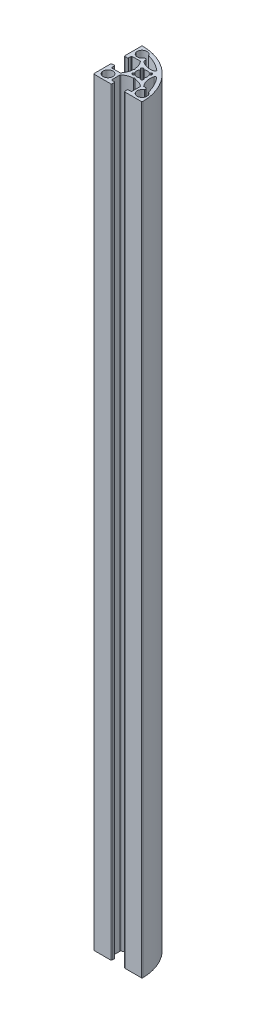
from build123d import *

# Parameters (mm, degrees)
SKETCH_1_R      = 2
EXTRUDE_1_DEPTH = 312


with BuildPart() as part:
    # 스케치1 → 보스-돌출1 (new body)
    with BuildSketch(Plane(origin=(0, 0, 0), x_dir=(1, 0, 0), z_dir=(0, 1, 0))):
        with BuildLine():
            Line((-10, 9.697715604), (-10, 2.95))
            ThreePointArc((-10, 2.95), (-9.912132034, 2.737867966), (-9.7, 2.65))
            Line((-9.7, 2.65), (-8.8, 2.65))
            ThreePointArc((-8.8, 2.65), (-8.587867966, 2.737867966), (-8.5, 2.95))
            Line((-8.5, 2.95), (-8.5, 3.85))
            ThreePointArc((-8.5, 3.85), (-8.412132034, 4.062132034), (-8.2, 4.15))
            Line((-8.2, 4.15), (-4.942749448, 4.15))
            ThreePointArc((-4.942749448, 4.15), (-4.812307598, 4.120157221), (-4.707817398, 4.03656616))
            ThreePointArc((-4.707817398, 4.03656616), (-3.714379176, 2.282021525), (-3.307277366, 0.307277366))
            Line((-3.307277366, 0.307277366), (-3, 0))
            Line((-3, 0), (-3.307277366, -0.307277366))
            ThreePointArc((-3.307277366, -0.307277366), (-3.714379176, -2.282021525), (-4.707817398, -4.03656616))
            ThreePointArc((-4.707817398, -4.03656616), (-4.812307598, -4.120157221), (-4.942749448, -4.15))
            Line((-4.942749448, -4.15), (-8.2, -4.15))
            ThreePointArc((-8.2, -4.15), (-8.412132034, -4.062132034), (-8.5, -3.85))
            Line((-8.5, -3.85), (-8.5, -2.95))
            ThreePointArc((-8.5, -2.95), (-8.587867966, -2.737867966), (-8.8, -2.65))
            Line((-8.8, -2.65), (-9.7, -2.65))
            ThreePointArc((-9.7, -2.65), (-9.912132034, -2.737867966), (-10, -2.95))
            Line((-10, -2.95), (-10, -9.7))
            ThreePointArc((-10, -9.7), (-9.912132034, -9.912132034), (-9.7, -10))
            Line((-9.7, -10), (-2.95, -10))
            ThreePointArc((-2.95, -10), (-2.737867966, -9.912132034), (-2.65, -9.7))
            Line((-2.65, -9.7), (-2.65, -8.8))
            ThreePointArc((-2.65, -8.8), (-2.737867966, -8.587867966), (-2.95, -8.5))
            Line((-2.95, -8.5), (-3.85, -8.5))
            ThreePointArc((-3.85, -8.5), (-4.062132034, -8.412132034), (-4.15, -8.2))
            Line((-4.15, -8.2), (-4.15, -4.942749448))
            ThreePointArc((-4.15, -4.942749448), (-4.120157221, -4.812307599), (-4.03656616, -4.707817398))
            ThreePointArc((-4.03656616, -4.707817398), (-2.282021525, -3.714379176), (-0.307277366, -3.307277366))
            Line((-0.307277366, -3.307277366), (0, -3))
            Line((0, -3), (0.307277366, -3.307277366))
            ThreePointArc((0.307277366, -3.307277366), (2.282021525, -3.714379176), (4.03656616, -4.707817398))
            ThreePointArc((4.03656616, -4.707817398), (4.120157221, -4.812307599), (4.15, -4.942749448))
            Line((4.15, -4.942749448), (4.15, -8.2))
            ThreePointArc((4.15, -8.2), (4.062132034, -8.412132034), (3.85, -8.5))
            Line((3.85, -8.5), (2.95, -8.5))
            ThreePointArc((2.95, -8.5), (2.737867966, -8.587867966), (2.65, -8.8))
            Line((2.65, -8.8), (2.65, -9.7))
            ThreePointArc((2.65, -9.7), (2.737867966, -9.912132034), (2.95, -10))
            Line((2.95, -10), (9.697715604, -10))
            ThreePointArc((9.697715604, -10), (9.911456754, -9.910510619), (9.997680816, -9.695431472))
            ThreePointArc((9.997680816, -9.695431472), (4.142135624, 4.142135624), (-9.695431472, 9.997680816))
            ThreePointArc((-9.695431472, 9.997680816), (-9.910510619, 9.911456754), (-10, 9.697715604))
        make_face()
        with Locations((-7, -7)):
            Circle(SKETCH_1_R, mode=Mode.SUBTRACT)
        with BuildLine():
            Line((6.15, -5.189613301), (6.15, -4.65))
            ThreePointArc((6.15, -4.65), (6.003553391, -4.296446609), (5.65, -4.15))
            Line((5.65, -4.15), (4.942749448, -4.15))
            ThreePointArc((4.942749448, -4.15), (4.812307599, -4.120157221), (4.707817398, -4.03656616))
            ThreePointArc((4.707817398, -4.03656616), (3.457261044, -1.420133589), (3.470927733, 1.479767066))
            ThreePointArc((3.470927733, 1.479767066), (3.845379716, 1.852984885), (4.345476458, 1.681494134))
            ThreePointArc((4.345476458, 1.681494134), (6.468692501, -1.571941665), (7.865655284, -5.197046609))
            ThreePointArc((7.865655284, -5.197046609), (6.991334811, -8.999981229), (6.15, -5.189613301))
        make_face(mode=Mode.SUBTRACT)
        with BuildLine():
            Line((-4.65, 6.15), (-5.189613301, 6.15))
            ThreePointArc((-5.189613301, 6.15), (-8.999981229, 6.991334811), (-5.197046609, 7.865655284))
            ThreePointArc((-5.197046609, 7.865655284), (-1.571941665, 6.468692501), (1.681494134, 4.345476458))
            ThreePointArc((1.681494134, 4.345476458), (1.852984885, 3.845379716), (1.479767066, 3.470927733))
            ThreePointArc((1.479767066, 3.470927733), (-1.420133589, 3.457261044), (-4.03656616, 4.707817398))
            ThreePointArc((-4.03656616, 4.707817398), (-4.120157221, 4.812307598), (-4.15, 4.942749448))
            Line((-4.15, 4.942749448), (-4.15, 5.65))
            ThreePointArc((-4.15, 5.65), (-4.296446609, 6.003553391), (-4.65, 6.15))
        make_face(mode=Mode.SUBTRACT)
        with BuildLine():
            ThreePointArc((-2.27262737, -1.958357689), (-2.345158518, -1.75140317), (-2.257496667, -1.550389886))
            Line((-2.257496667, -1.550389886), (-1.99100568, -1.283898899))
            ThreePointArc((-1.99100568, -1.283898899), (-1.907277277, -1.121431759), (-1.933365749, -0.940530106))
            ThreePointArc((-1.933365749, -0.940530106), (-2.15, 0), (-1.933365749, 0.940530106))
            ThreePointArc((-1.933365749, 0.940530106), (-1.907277277, 1.121431759), (-1.99100568, 1.283898899))
            Line((-1.99100568, 1.283898899), (-2.257496667, 1.550389886))
            ThreePointArc((-2.257496667, 1.550389886), (-2.345158518, 1.75140317), (-2.27262737, 1.958357689))
            ThreePointArc((-2.27262737, 1.958357689), (-2.121320344, 2.121320344), (-1.958357689, 2.27262737))
            ThreePointArc((-1.958357689, 2.27262737), (-1.75140317, 2.345158518), (-1.550389886, 2.257496667))
            Line((-1.550389886, 2.257496667), (-1.283898899, 1.99100568))
            ThreePointArc((-1.283898899, 1.99100568), (-1.121431759, 1.907277277), (-0.940530106, 1.933365749))
            ThreePointArc((-0.940530106, 1.933365749), (0, 2.15), (0.940530106, 1.933365749))
            ThreePointArc((0.940530106, 1.933365749), (1.12143176, 1.907277277), (1.283898899, 1.99100568))
            Line((1.283898899, 1.99100568), (1.550389886, 2.257496667))
            ThreePointArc((1.550389886, 2.257496667), (1.75140317, 2.345158518), (1.958357689, 2.27262737))
            ThreePointArc((1.958357689, 2.27262737), (2.121320344, 2.121320344), (2.27262737, 1.958357689))
            ThreePointArc((2.27262737, 1.958357689), (2.345158518, 1.75140317), (2.257496667, 1.550389886))
            Line((2.257496667, 1.550389886), (1.99100568, 1.283898899))
            ThreePointArc((1.99100568, 1.283898899), (1.907277277, 1.121431759), (1.933365749, 0.940530105))
            ThreePointArc((1.933365749, 0.940530105), (2.15, 0), (1.933365749, -0.940530106))
            ThreePointArc((1.933365749, -0.940530106), (1.907277277, -1.121431759), (1.99100568, -1.283898899))
            Line((1.99100568, -1.283898899), (2.257496667, -1.550389886))
            ThreePointArc((2.257496667, -1.550389886), (2.345158518, -1.75140317), (2.27262737, -1.958357689))
            ThreePointArc((2.27262737, -1.958357689), (2.121320344, -2.121320344), (1.958357689, -2.27262737))
            ThreePointArc((1.958357689, -2.27262737), (1.75140317, -2.345158518), (1.550389886, -2.257496667))
            Line((1.550389886, -2.257496667), (1.283898899, -1.99100568))
            ThreePointArc((1.283898899, -1.99100568), (1.121431759, -1.907277277), (0.940530106, -1.933365749))
            ThreePointArc((0.940530106, -1.933365749), (0, -2.15), (-0.940530105, -1.933365749))
            ThreePointArc((-0.940530105, -1.933365749), (-1.121431759, -1.907277277), (-1.283898899, -1.99100568))
            Line((-1.283898899, -1.99100568), (-1.550389886, -2.257496667))
            ThreePointArc((-1.550389886, -2.257496667), (-1.75140317, -2.345158518), (-1.958357689, -2.27262737))
            ThreePointArc((-1.958357689, -2.27262737), (-2.121320344, -2.121320344), (-2.27262737, -1.958357689))
        make_face(mode=Mode.SUBTRACT)
    extrude(amount=EXTRUDE_1_DEPTH)


solid = part.part
